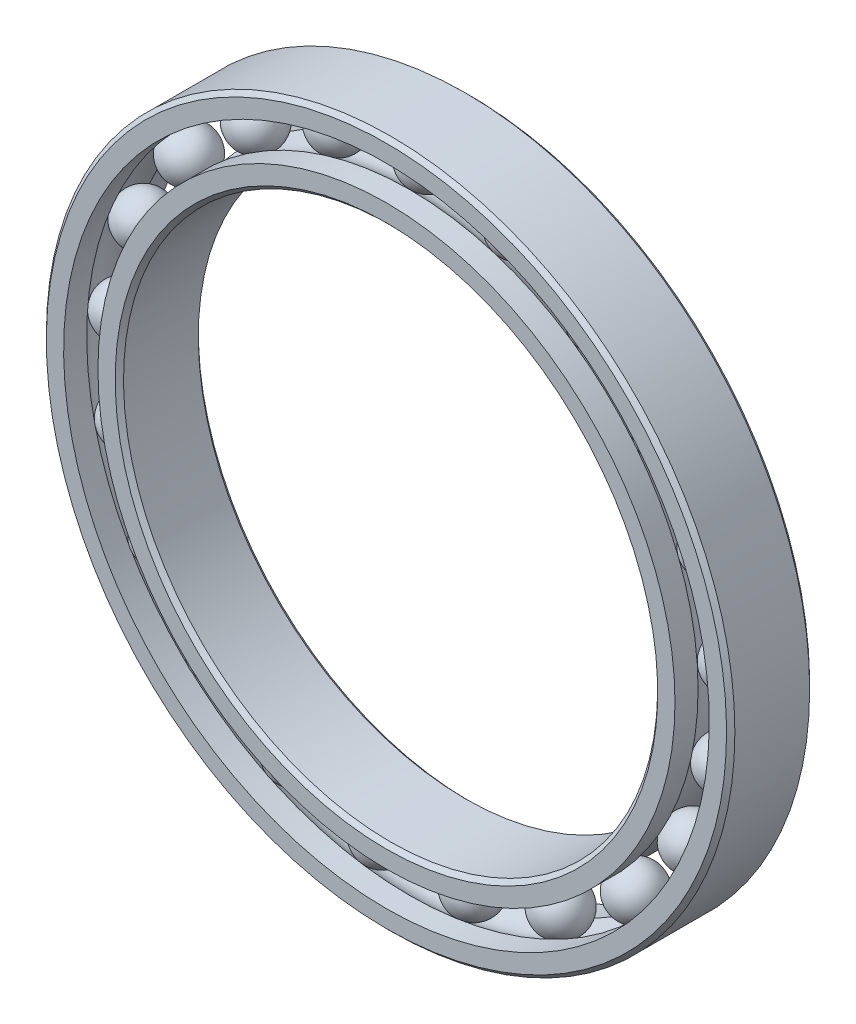
from build123d import *

# Parameters (mm, degrees)
CIRPATTERN1_COUNT = 21


with BuildPart() as part:
    # Sketch6 → Revolve5 (revolve)
    with BuildSketch(Plane(origin=(0, 0, 0), x_dir=(0, 0, -1), z_dir=(1, 0, 0)), mode=Mode.PRIVATE) as revolve5_sk:
        with BuildLine():
            Line((3.15, 29), (3.5, 28.65))
            Line((3.5, 28.65), (3.5, 27.194444444))
            Line((3.5, 27.194444444), (1.555555556, 27.194444444))
            ThreePointArc((1.555555556, 27.194444444), (0, 27.872774797), (-1.555555556, 27.194444444))
            Line((-1.555555556, 27.194444444), (-3.5, 27.194444444))
            Line((-3.5, 27.194444444), (-3.5, 28.65))
            Line((-3.5, 28.65), (-3.15, 29))
            Line((-3.15, 29), (3.15, 29))
        make_face()
    revolve(revolve5_sk.sketch.rotate(Axis((0, 0, 3.5), (0, 0, -1)), 180), axis=Axis((0, 0, 3.5), (0, 0, -1)))


with BuildPart() as body_2:
    # Sketch3 → Revolve3 (revolve)
    with BuildSketch(Plane(origin=(0, 0, 0), x_dir=(0, 0, -1), z_dir=(1, 0, 0)), mode=Mode.PRIVATE) as revolve3_sk:
        with BuildLine():
            Line((-3.5, 24.305555556), (-1.555555556, 24.305555556))
            ThreePointArc((-1.555555556, 24.305555556), (0, 23.627225203), (1.555555556, 24.305555556))
            Line((1.555555556, 24.305555556), (3.5, 24.305555556))
            Line((3.5, 24.305555556), (3.5, 22.85))
            Line((3.5, 22.85), (3.15, 22.5))
            Line((3.15, 22.5), (-3.15, 22.5))
            Line((-3.15, 22.5), (-3.5, 22.85))
            Line((-3.5, 22.85), (-3.5, 24.305555556))
        make_face()
    revolve(revolve3_sk.sketch.rotate(Axis((0, 0, 3.5), (0, 0, -1)), 180), axis=Axis((0, 0, 3.5), (0, 0, -1)))


with BuildPart() as body_3:
    # Sketch4 → Revolve4 (revolve)
    with BuildSketch(Plane(origin=(0, 0, 0), x_dir=(0, 0, -1), z_dir=(1, 0, 0))):
        with BuildLine():
            Line((-2.122774797, 25.75), (2.122774797, 25.75))
            ThreePointArc((2.122774797, 25.75), (0, 27.872774797), (-2.122774797, 25.75))
        make_face()
    revolve(axis=Axis((0, 25.75, 2.122774797), (0, 0, -1)))


with BuildPart() as cirpattern1_1:
    # CirPattern1: pattern copy
    add(body_3.part.rotate(Axis((0, 0, 0), (0, 0, 1)), 1 * 360 / CIRPATTERN1_COUNT))


with BuildPart() as cirpattern1_2:
    # CirPattern1: pattern copy
    add(body_3.part.rotate(Axis((0, 0, 0), (0, 0, 1)), 2 * 360 / CIRPATTERN1_COUNT))


with BuildPart() as cirpattern1_3:
    # CirPattern1: pattern copy
    add(body_3.part.rotate(Axis((0, 0, 0), (0, 0, 1)), 3 * 360 / CIRPATTERN1_COUNT))


with BuildPart() as cirpattern1_4:
    # CirPattern1: pattern copy
    add(body_3.part.rotate(Axis((0, 0, 0), (0, 0, 1)), 4 * 360 / CIRPATTERN1_COUNT))


with BuildPart() as cirpattern1_5:
    # CirPattern1: pattern copy
    add(body_3.part.rotate(Axis((0, 0, 0), (0, 0, 1)), 5 * 360 / CIRPATTERN1_COUNT))


with BuildPart() as cirpattern1_6:
    # CirPattern1: pattern copy
    add(body_3.part.rotate(Axis((0, 0, 0), (0, 0, 1)), 6 * 360 / CIRPATTERN1_COUNT))


with BuildPart() as cirpattern1_7:
    # CirPattern1: pattern copy
    add(body_3.part.rotate(Axis((0, 0, 0), (0, 0, 1)), 7 * 360 / CIRPATTERN1_COUNT))


with BuildPart() as cirpattern1_8:
    # CirPattern1: pattern copy
    add(body_3.part.rotate(Axis((0, 0, 0), (0, 0, 1)), 8 * 360 / CIRPATTERN1_COUNT))


with BuildPart() as cirpattern1_9:
    # CirPattern1: pattern copy
    add(body_3.part.rotate(Axis((0, 0, 0), (0, 0, 1)), 9 * 360 / CIRPATTERN1_COUNT))


with BuildPart() as cirpattern1_10:
    # CirPattern1: pattern copy
    add(body_3.part.rotate(Axis((0, 0, 0), (0, 0, 1)), 10 * 360 / CIRPATTERN1_COUNT))


with BuildPart() as cirpattern1_11:
    # CirPattern1: pattern copy
    add(body_3.part.rotate(Axis((0, 0, 0), (0, 0, 1)), 11 * 360 / CIRPATTERN1_COUNT))


with BuildPart() as cirpattern1_12:
    # CirPattern1: pattern copy
    add(body_3.part.rotate(Axis((0, 0, 0), (0, 0, 1)), 12 * 360 / CIRPATTERN1_COUNT))


with BuildPart() as cirpattern1_13:
    # CirPattern1: pattern copy
    add(body_3.part.rotate(Axis((0, 0, 0), (0, 0, 1)), 13 * 360 / CIRPATTERN1_COUNT))


with BuildPart() as cirpattern1_14:
    # CirPattern1: pattern copy
    add(body_3.part.rotate(Axis((0, 0, 0), (0, 0, 1)), 14 * 360 / CIRPATTERN1_COUNT))


with BuildPart() as cirpattern1_15:
    # CirPattern1: pattern copy
    add(body_3.part.rotate(Axis((0, 0, 0), (0, 0, 1)), 15 * 360 / CIRPATTERN1_COUNT))


with BuildPart() as cirpattern1_16:
    # CirPattern1: pattern copy
    add(body_3.part.rotate(Axis((0, 0, 0), (0, 0, 1)), 16 * 360 / CIRPATTERN1_COUNT))


with BuildPart() as cirpattern1_17:
    # CirPattern1: pattern copy
    add(body_3.part.rotate(Axis((0, 0, 0), (0, 0, 1)), 17 * 360 / CIRPATTERN1_COUNT))


with BuildPart() as cirpattern1_18:
    # CirPattern1: pattern copy
    add(body_3.part.rotate(Axis((0, 0, 0), (0, 0, 1)), 18 * 360 / CIRPATTERN1_COUNT))


with BuildPart() as cirpattern1_19:
    # CirPattern1: pattern copy
    add(body_3.part.rotate(Axis((0, 0, 0), (0, 0, 1)), 19 * 360 / CIRPATTERN1_COUNT))


with BuildPart() as cirpattern1_20:
    # CirPattern1: pattern copy
    add(body_3.part.rotate(Axis((0, 0, 0), (0, 0, 1)), 20 * 360 / CIRPATTERN1_COUNT))


solid = Compound([part.part, body_2.part, body_3.part, cirpattern1_1.part, cirpattern1_2.part, cirpattern1_3.part, cirpattern1_4.part, cirpattern1_5.part, cirpattern1_6.part, cirpattern1_7.part, cirpattern1_8.part, cirpattern1_9.part, cirpattern1_10.part, cirpattern1_11.part, cirpattern1_12.part, cirpattern1_13.part, cirpattern1_14.part, cirpattern1_15.part, cirpattern1_16.part, cirpattern1_17.part, cirpattern1_18.part, cirpattern1_19.part, cirpattern1_20.part])
